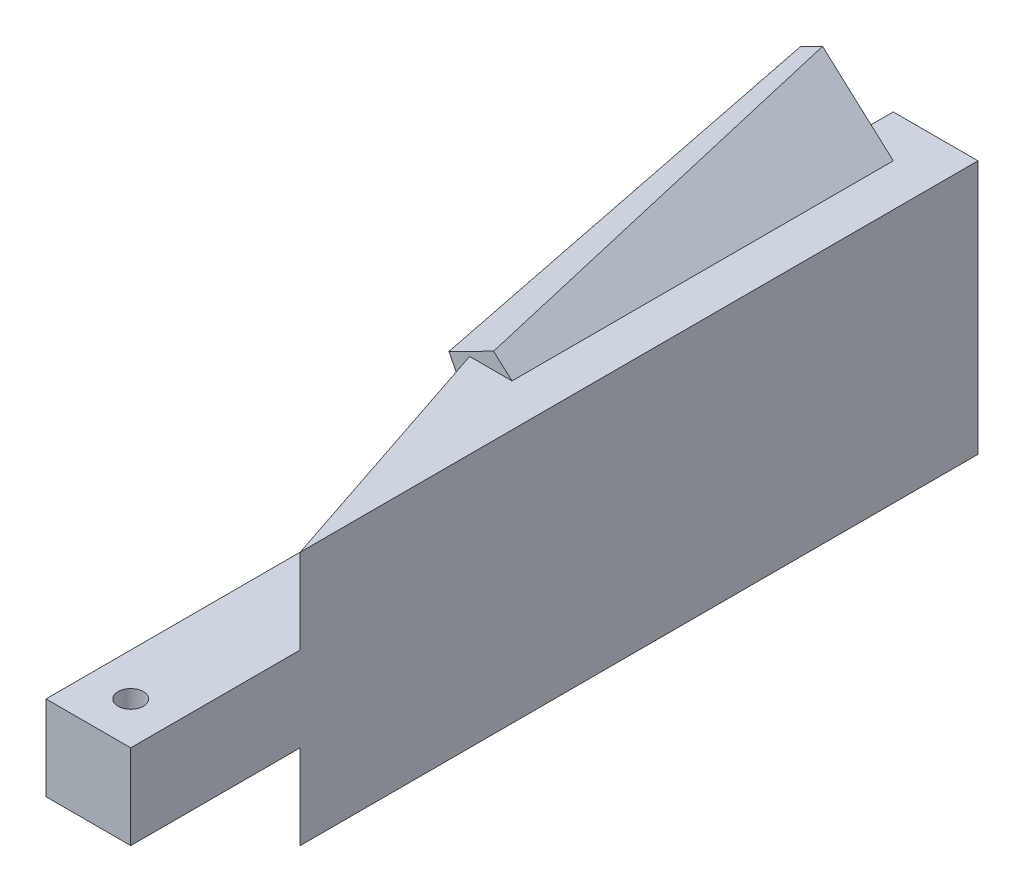
from build123d import *

# Parameters (mm, degrees)
CROQUIS1_R              = 55
CROQUIS1_W              = 45
CROQUIS1_H              = 15
SALIENTE_EXTRUIR1_DEPTH = 10
CROQUIS2_W              = 10
CROQUIS2_H              = 30
SALIENTE_EXTRUIR2_DEPTH = 95
CROQUIS3_R              = 1.5
CORTAR_EXTRUIR1_DEPTH   = 50
CORTAR_EXTRUIR2_DEPTH   = 10
CROQUIS5_R              = 2.5
CORTAR_EXTRUIR3_DEPTH   = 85
CROQUIS7_R              = 2.5
SALIENTE_EXTRUIR3_DEPTH = 5
CORTAR_EXTRUIR4_DEPTH   = 10
CROQUIS10_R             = 2.575
CROQUIS11_OUTSIDE_W     = 149.536
CROQUIS11_OUTSIDE_H     = 144.536
CROQUIS11_OUTSIDE_W_2   = 10
CROQUIS11_OUTSIDE_H_2   = 100
CORTAR_EXTRUIR5_DEPTH   = 105.5
CROQUIS12_OUTSIDE_W     = 40.072
CROQUIS12_OUTSIDE_H     = 128.052
CROQUIS12_OUTSIDE_W_2   = 10
CROQUIS12_OUTSIDE_H_2   = 30
CORTAR_EXTRUIR6_DEPTH   = 10
SALIENTE_EXTRUIR4_DEPTH = 50
CORTAR_EXTRUIR7_DEPTH   = 30
CROQUIS18_OUTSIDE_W     = 40.218
CROQUIS18_OUTSIDE_H     = 70.744
CROQUIS18_OUTSIDE_W_2   = 10
CROQUIS18_OUTSIDE_H_2   = 30
CORTAR_EXTRUIR8_DEPTH   = 5


with BuildPart() as part:
    # Croquis1 → Saliente-Extruir1 (new body)
    with BuildSketch(Plane.XY):
        Circle(CROQUIS1_R)
        with Locations((0, -2.5)):
            Rectangle(CROQUIS1_W, CROQUIS1_H, mode=Mode.SUBTRACT)
    extrude(amount=SALIENTE_EXTRUIR1_DEPTH)

    # Croquis2 → Saliente-Extruir2 (add)
    with BuildSketch(Plane.XY.offset(10)):
        with Locations((30, 0)):
            Rectangle(CROQUIS2_W, CROQUIS2_H)
    extrude(amount=SALIENTE_EXTRUIR2_DEPTH)

    # Croquis3 → Cortar-Extruir1 (cut)
    with BuildSketch(Plane.XZ.offset(15)):
        with Locations((30, 100)):
            Circle(CROQUIS3_R)
    extrude(amount=-CORTAR_EXTRUIR1_DEPTH, mode=Mode.SUBTRACT)

    # Croquis4 → Cortar-Extruir2 (cut)
    with BuildSketch(Plane.XZ.offset(15)):
        Polygon((35, 85), (25, 55), (25, 95), (25, 105), (35, 105), align=None)
    cortar_extruir2 = extrude(amount=-CORTAR_EXTRUIR2_DEPTH, mode=Mode.SUBTRACT)

    # Simetría1: Cortar-Extruir2 across plane
    add(cortar_extruir2.mirror(Plane.ZX), mode=Mode.SUBTRACT)

    # Croquis5 → Cortar-Extruir3 (cut, symmetric)
    with BuildSketch(Plane.XZ.offset(-5)):
        with Locations(Location((0, 5, 0), (0, 0, 270))):
            Circle(CROQUIS5_R)
    extrude(amount=CORTAR_EXTRUIR3_DEPTH, both=True, mode=Mode.SUBTRACT)

    # Croquis7 → Saliente-Extruir3 (add)
    with BuildSketch(Plane.XY.offset(10)):
        with Locations((0, 48.5)):
            Circle(CROQUIS7_R)
    extrude(amount=SALIENTE_EXTRUIR3_DEPTH)

    # Croquis8 → Cortar-Extruir4 (cut)
    with BuildSketch(Plane.XY.offset(10)):
        with BuildLine():
            Line((8.999999995, 39.891287847), (8.999999995, 38.6))
            Line((8.999999995, 38.6), (7.708712148, 38.6))
            ThreePointArc((7.708712148, 38.6), (7.499999995, 37.6), (7.708712148, 36.6))
            Line((7.708712148, 36.6), (8.999999995, 36.6))
            Line((8.999999995, 36.6), (8.999999995, 35.308712153))
            ThreePointArc((8.999999995, 35.308712153), (9.999999995, 35.1), (10.999999995, 35.308712153))
            Line((10.999999995, 35.308712153), (10.999999995, 36.6))
            Line((10.999999995, 36.6), (12.291287843, 36.6))
            ThreePointArc((12.291287843, 36.6), (12.499999995, 37.6), (12.291287843, 38.6))
            Line((12.291287843, 38.6), (10.999999995, 38.6))
            Line((10.999999995, 38.6), (10.999999995, 39.891287847))
            ThreePointArc((10.999999995, 39.891287847), (9.999999995, 40.1), (8.999999995, 39.891287847))
        make_face()
        with BuildLine():
            Line((-7.708712157, 36.6), (-9.000000005, 36.6))
            Line((-9.000000005, 36.6), (-9.000000005, 35.308712153))
            ThreePointArc((-9.000000005, 35.308712153), (-10.000000005, 35.1), (-11.000000005, 35.308712153))
            Line((-11.000000005, 35.308712153), (-11.000000005, 36.6))
            Line((-11.000000005, 36.6), (-12.291287852, 36.6))
            ThreePointArc((-12.291287852, 36.6), (-12.500000005, 37.6), (-12.291287852, 38.6))
            Line((-12.291287852, 38.6), (-11.000000005, 38.6))
            Line((-11.000000005, 38.6), (-11.000000005, 39.891287847))
            ThreePointArc((-11.000000005, 39.891287847), (-10.000000005, 40.1), (-9.000000005, 39.891287847))
            Line((-9.000000005, 39.891287847), (-9.000000005, 38.6))
            Line((-9.000000005, 38.6), (-7.708712157, 38.6))
            ThreePointArc((-7.708712157, 38.6), (-7.500000005, 37.6), (-7.708712157, 36.6))
        make_face()
        with BuildLine():
            Line((-7.708712153, -35.749999986), (-9, -35.749999986))
            Line((-9, -35.749999986), (-9, -37.041287833))
            ThreePointArc((-9, -37.041287833), (-10, -37.249999986), (-11, -37.041287833))
            Line((-11, -37.041287833), (-11, -35.749999986))
            Line((-11, -35.749999986), (-12.291287847, -35.749999986))
            ThreePointArc((-12.291287847, -35.749999986), (-12.5, -34.749999986), (-12.291287847, -33.749999986))
            Line((-12.291287847, -33.749999986), (-11, -33.749999986))
            Line((-11, -33.749999986), (-11, -32.458712138))
            ThreePointArc((-11, -32.458712138), (-10, -32.249999986), (-9, -32.458712138))
            Line((-9, -32.458712138), (-9, -33.749999986))
            Line((-9, -33.749999986), (-7.708712153, -33.749999986))
            ThreePointArc((-7.708712153, -33.749999986), (-7.5, -34.749999986), (-7.708712153, -35.749999986))
        make_face()
        with BuildLine():
            Line((8.999999991, -35.749999986), (8.999999991, -37.041287833))
            ThreePointArc((8.999999991, -37.041287833), (9.999999991, -37.249999986), (10.999999991, -37.041287833))
            Line((10.999999991, -37.041287833), (10.999999991, -35.749999986))
            Line((10.999999991, -35.749999986), (12.291287838, -35.749999986))
            ThreePointArc((12.291287838, -35.749999986), (12.499999991, -34.749999986), (12.291287838, -33.749999986))
            Line((12.291287838, -33.749999986), (10.999999991, -33.749999986))
            Line((10.999999991, -33.749999986), (10.999999991, -32.458712138))
            ThreePointArc((10.999999991, -32.458712138), (9.999999991, -32.249999986), (8.999999991, -32.458712138))
            Line((8.999999991, -32.458712138), (8.999999991, -33.749999986))
            Line((8.999999991, -33.749999986), (7.708712143, -33.749999986))
            ThreePointArc((7.708712143, -33.749999986), (7.499999991, -34.749999986), (7.708712143, -35.749999986))
            Line((7.708712143, -35.749999986), (8.999999991, -35.749999986))
        make_face()
    extrude(amount=-CORTAR_EXTRUIR4_DEPTH, mode=Mode.SUBTRACT)

    # Croquis10 → Cortar-Revolución1 (revolve, cut)
    with BuildSketch(Plane(origin=(0, 0, 0), x_dir=(1, 0, 0), z_dir=(0, 1, 0))):
        with Locations((-55, -5)):
            Circle(CROQUIS10_R)
    revolve(axis=Axis((0, 0, 0), (0, 0, 1)), mode=Mode.SUBTRACT)

    # Croquis11 outside → Cortar-Extruir5 (cut, symmetric)
    with BuildSketch(Plane(origin=(0, 15, 0), x_dir=(1, 0, 0), z_dir=(0, 1, 0))):
        with Locations((0, -52.5)):
            Rectangle(CROQUIS11_OUTSIDE_W, CROQUIS11_OUTSIDE_H)
        with Locations((30, -55)):
            Rectangle(CROQUIS11_OUTSIDE_W_2, CROQUIS11_OUTSIDE_H_2, mode=Mode.SUBTRACT)
    extrude(amount=CORTAR_EXTRUIR5_DEPTH, both=True, mode=Mode.SUBTRACT)

    # Croquis12 outside → Cortar-Extruir6 (cut)
    with BuildSketch(Plane.XY.offset(10)):
        with Locations((30, 0)):
            Rectangle(CROQUIS12_OUTSIDE_W, CROQUIS12_OUTSIDE_H)
        with Locations((30, 0)):
            Rectangle(CROQUIS12_OUTSIDE_W_2, CROQUIS12_OUTSIDE_H_2, mode=Mode.SUBTRACT)
    extrude(amount=-CORTAR_EXTRUIR6_DEPTH, mode=Mode.SUBTRACT)

    # Croquis15 → Saliente-Extruir4 (add)
    with BuildSketch(Plane(origin=(0, 0, 5), x_dir=(-1, 0, 0), z_dir=(0, 0, -1))):
        Polygon((-30, 15), (-20.877471703, 23.230682918), (-19.064126659, 21.220850729), (-25, 9.458219088), align=None)
    saliente_extruir4 = extrude(amount=-SALIENTE_EXTRUIR4_DEPTH)

    # Croquis17 → Cortar-Extruir7 (cut)
    with BuildSketch(Plane(origin=(23.729923141, 11.975025866, 0), x_dir=(0, 0, 1), z_dir=(-0.8927647254437483, -0.4505231903058363, 0))):
        Polygon((55, 2.599765556), (10, 10.356395812), (-8.093174243, 24.440719527), (32.70757592, 13.533993104), (58.299435985, 13.533993104), align=None)
    cortar_extruir7 = extrude(amount=-CORTAR_EXTRUIR7_DEPTH, mode=Mode.SUBTRACT)

    # Simetría2: Saliente-Extruir4, Cortar-Extruir7 across plane
    add(saliente_extruir4.mirror(Plane.ZX))
    add(cortar_extruir7.mirror(Plane.ZX), mode=Mode.SUBTRACT)

    # Croquis18 outside → Cortar-Extruir8 (cut)
    with BuildSketch(Plane(origin=(0, 0, 5), x_dir=(-1, 0, 0), z_dir=(0, 0, -1))):
        with Locations((-27.032, 0)):
            Rectangle(CROQUIS18_OUTSIDE_W, CROQUIS18_OUTSIDE_H)
        with Locations((-30, 0)):
            Rectangle(CROQUIS18_OUTSIDE_W_2, CROQUIS18_OUTSIDE_H_2, mode=Mode.SUBTRACT)
    extrude(amount=-CORTAR_EXTRUIR8_DEPTH, mode=Mode.SUBTRACT)


solid = part.part
